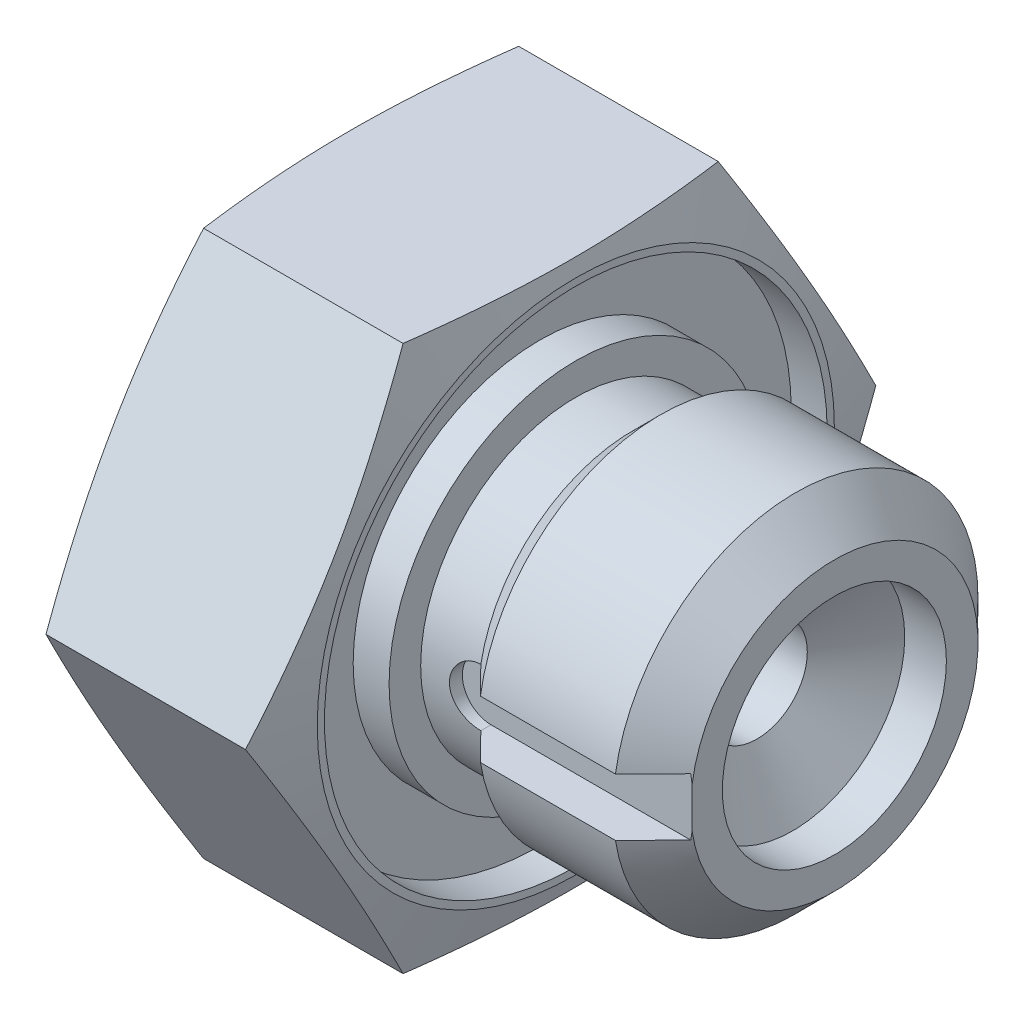
from build123d import *

# Parameters (mm, degrees)
SKETCH2_OUTSIDE_W  = 41.142
SKETCH2_OUTSIDE_H  = 41.142
CUT_EXTRUDE1_DEPTH = 28.184554438
CUT_EXTRUDE3_DEPTH = 10


with BuildPart() as part:
    # Sketch1 → Revolve1 (revolve)
    with BuildSketch(Plane.XY, mode=Mode.PRIVATE) as revolve1_sk:
        Polygon((0, 3.9), (0, 5), (-1.35, 6.35), (-6.05, 6.35), (-7, 5.4), (-9, 5.4), (-9, 6.5), (-10.25, 6.5), (-10.25, 8.75), (-9, 8.75), (-9, 9), (-10.607695155, 15), (-15.392304845, 15), (-17, 9), (-17, 1.75), (-2.691303079, 1.75), (-1.45, 3.9), align=None)
    revolve(revolve1_sk.sketch.rotate(Axis((0, 0, 0), (-1, 0, 0)), 90), axis=Axis((0, 0, 0), (-1, 0, 0)))

    # Sketch2 outside → Cut-Extrude1 (cut, through all)
    with BuildSketch(Plane.ZY.offset(17)):
        Rectangle(SKETCH2_OUTSIDE_W, SKETCH2_OUTSIDE_H)
        Polygon((10.969655115, 0), (5.484827557, 9.5), (-5.484827557, 9.5), (-10.969655115, 0), (-5.484827557, -9.5), (5.484827557, -9.5), align=None, mode=Mode.SUBTRACT)
    extrude(amount=-CUT_EXTRUDE1_DEPTH, mode=Mode.SUBTRACT)

    # Sketch3 → Cut-Extrude3 (cut)
    with BuildSketch(Plane.XY.offset(4.95)):
        with BuildLine():
            Line((0, 1), (-7, 1))
            ThreePointArc((-7, 1), (-8, 0), (-7, -1))
            Line((-7, -1), (0, -1))
            Line((0, -1), (0, 0))
            Line((0, 0), (0, 1))
        make_face()
    extrude(amount=CUT_EXTRUDE3_DEPTH, mode=Mode.SUBTRACT)


solid = part.part
